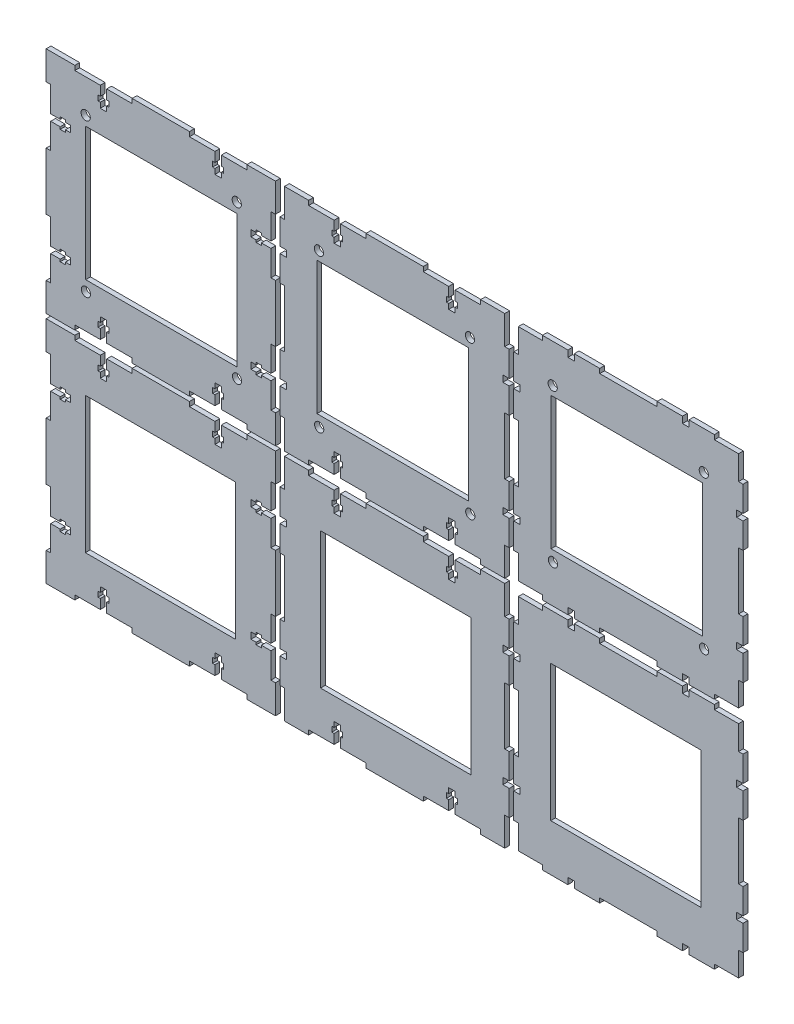
from build123d import *

# Parameters (mm, degrees)
MODEL_W               = 99.328164321
MODEL_H               = 90
BOSS_EXTRUDE1_DEPTH   = 3.175
BOSS_EXTRUDE1_2_DEPTH = 3.175
BOSS_EXTRUDE1_3_DEPTH = 3.175
MODEL_R               = 3.05
MODEL_W_2             = 99.973098966
MODEL_H_2             = 87.745085512
BOSS_EXTRUDE1_4_DEPTH = 3.175
MODEL_W_3             = 99.973098965
BOSS_EXTRUDE1_5_DEPTH = 3.175
BOSS_EXTRUDE1_6_DEPTH = 3.175


with BuildPart() as part:
    # Model → Boss-Extrude1 (new body)
    with BuildSketch(Plane.XY):
        Polygon((0, 154.39750188), (0, 135.470394989), (2.980646754, 135.470394989), (2.980646754, 118.65457955), (9.289682385, 118.65457955), (9.289682385, 120.144902927), (12.717426152, 120.144902927), (12.717426152, 118.65457955), (16.14516992, 118.65457955), (16.14516992, 114.431996648), (12.717426152, 114.431996648), (12.717426152, 112.94167327), (9.289682385, 112.94167327), (9.289682385, 114.431996648), (2.980646754, 114.431996648), (2.980646754, 97.616181208), (0, 97.616181208), (0, 59.761967427), (2.980646754, 59.761967427), (2.980646754, 42.946151987), (9.289682385, 42.946151987), (9.289682385, 44.436475364), (12.717426152, 44.436475364), (12.717426152, 42.946151987), (16.14516992, 42.946151987), (16.14516992, 38.723569085), (12.717426152, 38.723569085), (12.717426152, 37.233245708), (9.289682385, 37.233245708), (9.289682385, 38.723569085), (2.980646754, 38.723569085), (2.980646754, 21.907753645), (0, 21.907753645), (0, 2.980646754), (18.927106891, 2.980646754), (18.927106891, 5.961293509), (35.74292233, 5.961293509), (35.74292233, 12.270329139), (34.252598953, 12.270329139), (34.252598953, 15.698072907), (35.74292233, 15.698072907), (35.74292233, 19.125816674), (39.965505232, 19.125816674), (39.965505232, 15.698072907), (41.45582861, 15.698072907), (41.45582861, 12.270329139), (39.965505232, 12.270329139), (39.965505232, 5.961293509), (56.781320672, 5.961293509), (56.781320672, 2.980646754), (94.635534454, 2.980646754), (94.635534454, 5.961293509), (111.451349893, 5.961293509), (111.451349893, 12.270329139), (109.961026516, 12.270329139), (109.961026516, 15.698072907), (111.451349893, 15.698072907), (111.451349893, 19.125816674), (115.673932795, 19.125816674), (115.673932795, 15.698072907), (117.164256172, 15.698072907), (117.164256172, 12.270329139), (115.673932795, 12.270329139), (115.673932795, 5.961293509), (132.489748235, 5.961293509), (132.489748235, 2.980646754), (151.416855126, 2.980646754), (151.416855126, 21.907753645), (148.436208371, 21.907753645), (148.436208371, 38.723569085), (142.127172741, 38.723569085), (142.127172741, 37.233245708), (138.699428973, 37.233245708), (138.699428973, 38.723569085), (135.271685206, 38.723569085), (135.271685206, 42.946151987), (138.699428973, 42.946151987), (138.699428973, 44.436475364), (142.127172741, 44.436475364), (142.127172741, 42.946151987), (148.436208371, 42.946151987), (148.436208371, 59.761967427), (151.416855126, 59.761967427), (151.416855126, 97.616181208), (148.436208371, 97.616181208), (148.436208371, 114.431996648), (142.127172741, 114.431996648), (142.127172741, 112.94167327), (138.699428973, 112.94167327), (138.699428973, 114.431996648), (135.271685206, 114.431996648), (135.271685206, 118.65457955), (138.699428973, 118.65457955), (138.699428973, 120.144902927), (142.127172741, 120.144902927), (142.127172741, 118.65457955), (148.436208371, 118.65457955), (148.436208371, 135.470394989), (151.416855126, 135.470394989), (151.416855126, 154.39750188), (132.489748235, 154.39750188), (132.489748235, 151.416855126), (115.673932795, 151.416855126), (115.673932795, 145.107819495), (117.164256172, 145.107819495), (117.164256172, 141.680075728), (115.673932795, 141.680075728), (115.673932795, 138.25233196), (111.451349893, 138.25233196), (111.451349893, 141.680075728), (109.961026516, 141.680075728), (109.961026516, 145.107819495), (111.451349893, 145.107819495), (111.451349893, 151.416855126), (94.635534454, 151.416855126), (94.635534454, 154.39750188), (56.781320672, 154.39750188), (56.781320672, 151.416855126), (39.965505232, 151.416855126), (39.965505232, 145.107819495), (41.45582861, 145.107819495), (41.45582861, 141.680075728), (39.965505232, 141.680075728), (39.965505232, 138.25233196), (35.74292233, 138.25233196), (35.74292233, 141.680075728), (34.252598953, 141.680075728), (34.252598953, 145.107819495), (35.74292233, 145.107819495), (35.74292233, 151.416855126), (18.927106891, 151.416855126), (18.927106891, 154.39750188), align=None)
        with Locations((75.534273285, 78.552155403)):
            Rectangle(MODEL_W, MODEL_H, mode=Mode.SUBTRACT)
    extrude(amount=BOSS_EXTRUDE1_DEPTH)


with BuildPart() as body_2:
    # Model → Boss-Extrude1 2 (new body)
    with BuildSketch(Plane.XY):
        Polygon((157.378148634, 154.39750188), (157.378148634, 135.470394989), (154.39750188, 135.470394989), (154.39750188, 118.65457955), (158.620084782, 118.65457955), (158.620084782, 116.543288099), (158.620084782, 114.431996648), (154.39750188, 114.431996648), (154.39750188, 97.616181208), (157.378148634, 97.616181208), (157.378148634, 59.761967427), (154.39750188, 59.761967427), (154.39750188, 42.946151987), (158.620084782, 42.946151987), (158.620084782, 40.834860536), (158.620084782, 38.723569085), (154.39750188, 38.723569085), (154.39750188, 21.907753645), (157.378148634, 21.907753645), (157.378148634, 2.980646754), (173.324608771, 2.980646754), (173.324608771, 5.961293509), (190.14042421, 5.961293509), (190.14042421, 12.270329139), (188.650100833, 12.270329139), (188.650100833, 15.698072907), (190.14042421, 15.698072907), (190.14042421, 19.125816674), (194.363007113, 19.125816674), (194.363007113, 15.698072907), (195.85333049, 15.698072907), (195.85333049, 12.270329139), (194.363007113, 12.270329139), (194.363007113, 5.961293509), (211.178822552, 5.961293509), (211.178822552, 2.980646754), (249.033036334, 2.980646754), (249.033036334, 5.961293509), (265.848851773, 5.961293509), (265.848851773, 12.270329139), (264.358528396, 12.270329139), (264.358528396, 15.698072907), (265.848851773, 15.698072907), (265.848851773, 19.125816674), (270.071434675, 19.125816674), (270.071434675, 15.698072907), (271.561758053, 15.698072907), (271.561758053, 12.270329139), (270.071434675, 12.270329139), (270.071434675, 5.961293509), (286.887250115, 5.961293509), (286.887250115, 2.980646754), (302.833710251, 2.980646754), (302.833710251, 21.907753645), (305.814357006, 21.907753645), (305.814357006, 38.723569085), (301.591774104, 38.723569085), (301.591774104, 40.834860536), (301.591774104, 42.946151987), (305.814357006, 42.946151987), (305.814357006, 59.761967427), (302.833710251, 59.761967427), (302.833710251, 97.616181208), (305.814357006, 97.616181208), (305.814357006, 114.431996648), (301.591774104, 114.431996648), (301.591774104, 116.543288099), (301.591774104, 118.65457955), (305.814357006, 118.65457955), (305.814357006, 135.470394989), (302.833710251, 135.470394989), (302.833710251, 154.39750188), (286.887250115, 154.39750188), (286.887250115, 151.416855126), (270.071434675, 151.416855126), (270.071434675, 145.107819495), (271.561758053, 145.107819495), (271.561758053, 141.680075728), (270.071434675, 141.680075728), (270.071434675, 138.25233196), (265.848851773, 138.25233196), (265.848851773, 141.680075728), (264.358528396, 141.680075728), (264.358528396, 145.107819495), (265.848851773, 145.107819495), (265.848851773, 151.416855126), (249.033036334, 151.416855126), (249.033036334, 154.39750188), (211.178822552, 154.39750188), (211.178822552, 151.416855126), (194.363007113, 151.416855126), (194.363007113, 145.107819495), (195.85333049, 145.107819495), (195.85333049, 141.680075728), (194.363007113, 141.680075728), (194.363007113, 138.25233196), (190.14042421, 138.25233196), (190.14042421, 141.680075728), (188.650100833, 141.680075728), (188.650100833, 145.107819495), (190.14042421, 145.107819495), (190.14042421, 151.416855126), (173.324608771, 151.416855126), (173.324608771, 154.39750188), align=None)
        with Locations((230.857017421, 78.761485247)):
            Rectangle(MODEL_W, MODEL_H, mode=Mode.SUBTRACT)
    extrude(amount=BOSS_EXTRUDE1_2_DEPTH)


with BuildPart() as body_3:
    # Model → Boss-Extrude1 3 (new body)
    with BuildSketch(Plane.XY):
        Polygon((311.775650515, 151.416855126), (311.775650515, 135.470394989), (308.79500376, 135.470394989), (308.79500376, 118.65457955), (313.017586662, 118.65457955), (313.017586662, 116.543288099), (313.017586662, 114.431996648), (308.79500376, 114.431996648), (308.79500376, 97.616181208), (311.775650515, 97.616181208), (311.775650515, 59.761967427), (308.79500376, 59.761967427), (308.79500376, 42.946151987), (313.017586662, 42.946151987), (313.017586662, 40.834860536), (313.017586662, 38.723569085), (308.79500376, 38.723569085), (308.79500376, 21.907753645), (311.775650515, 21.907753645), (311.775650515, 5.961293509), (327.722110651, 5.961293509), (327.722110651, 2.980646754), (344.53792609, 2.980646754), (344.53792609, 7.203229657), (346.649217542, 7.203229657), (348.760508993, 7.203229657), (348.760508993, 2.980646754), (365.576324432, 2.980646754), (365.576324432, 5.961293509), (403.430538214, 5.961293509), (403.430538214, 2.980646754), (420.246353653, 2.980646754), (420.246353653, 7.203229657), (422.357645104, 7.203229657), (424.468936555, 7.203229657), (424.468936555, 2.980646754), (441.284751995, 2.980646754), (441.284751995, 5.961293509), (457.231212131, 5.961293509), (457.231212131, 21.907753645), (460.211858886, 21.907753645), (460.211858886, 38.723569085), (455.989275984, 38.723569085), (455.989275984, 40.834860536), (455.989275984, 42.946151987), (460.211858886, 42.946151987), (460.211858886, 59.761967427), (457.231212131, 59.761967427), (457.231212131, 97.616181208), (460.211858886, 97.616181208), (460.211858886, 114.431996648), (455.989275984, 114.431996648), (455.989275984, 116.543288099), (455.989275984, 118.65457955), (460.211858886, 118.65457955), (460.211858886, 135.470394989), (457.231212131, 135.470394989), (457.231212131, 151.416855126), (441.284751995, 151.416855126), (441.284751995, 154.39750188), (424.468936555, 154.39750188), (424.468936555, 150.174918978), (422.357645104, 150.174918978), (420.246353653, 150.174918978), (420.246353653, 154.39750188), (403.430538214, 154.39750188), (403.430538214, 151.416855126), (365.576324432, 151.416855126), (365.576324432, 154.39750188), (348.760508993, 154.39750188), (348.760508993, 150.174918978), (346.649217542, 150.174918978), (344.53792609, 150.174918978), (344.53792609, 154.39750188), (327.722110651, 154.39750188), (327.722110651, 151.416855126), align=None)
        with Locations((382.889096412, 78.933135719)):
            Rectangle(MODEL_W, MODEL_H, mode=Mode.SUBTRACT)
    extrude(amount=BOSS_EXTRUDE1_3_DEPTH)


with BuildPart() as body_4:
    # Model → Boss-Extrude1 4 (new body)
    with BuildSketch(Plane.XY):
        Polygon((0, 308.79500376), (0, 289.867896869), (2.980646754, 289.867896869), (2.980646754, 273.05208143), (9.289682385, 273.05208143), (9.289682385, 274.542404807), (12.717426152, 274.542404807), (12.717426152, 273.05208143), (16.14516992, 273.05208143), (16.14516992, 268.829498528), (12.717426152, 268.829498528), (12.717426152, 267.33917515), (9.289682385, 267.33917515), (9.289682385, 268.829498528), (2.980646754, 268.829498528), (2.980646754, 252.013683088), (0, 252.013683088), (0, 214.159469307), (2.980646754, 214.159469307), (2.980646754, 197.343653867), (9.289682385, 197.343653867), (9.289682385, 198.833977244), (12.717426152, 198.833977244), (12.717426152, 197.343653867), (16.14516992, 197.343653867), (16.14516992, 193.121070965), (12.717426152, 193.121070965), (12.717426152, 191.630747588), (9.289682385, 191.630747588), (9.289682385, 193.121070965), (2.980646754, 193.121070965), (2.980646754, 176.305255525), (0, 176.305255525), (0, 157.378148634), (18.927106891, 157.378148634), (18.927106891, 160.358795389), (35.74292233, 160.358795389), (35.74292233, 166.667831019), (34.252598953, 166.667831019), (34.252598953, 170.095574787), (35.74292233, 170.095574787), (35.74292233, 173.523318554), (39.965505232, 173.523318554), (39.965505232, 170.095574787), (41.45582861, 170.095574787), (41.45582861, 166.667831019), (39.965505232, 166.667831019), (39.965505232, 160.358795389), (56.781320672, 160.358795389), (56.781320672, 157.378148634), (94.635534454, 157.378148634), (94.635534454, 160.358795389), (111.451349893, 160.358795389), (111.451349893, 166.667831019), (109.961026516, 166.667831019), (109.961026516, 170.095574787), (111.451349893, 170.095574787), (111.451349893, 173.523318554), (115.673932795, 173.523318554), (115.673932795, 170.095574787), (117.164256172, 170.095574787), (117.164256172, 166.667831019), (115.673932795, 166.667831019), (115.673932795, 160.358795389), (132.489748235, 160.358795389), (132.489748235, 157.378148634), (151.416855126, 157.378148634), (151.416855126, 176.305255525), (148.436208371, 176.305255525), (148.436208371, 193.121070965), (142.127172741, 193.121070965), (142.127172741, 191.630747588), (138.699428973, 191.630747588), (138.699428973, 193.121070965), (135.271685206, 193.121070965), (135.271685206, 197.343653867), (138.699428973, 197.343653867), (138.699428973, 198.833977244), (142.127172741, 198.833977244), (142.127172741, 197.343653867), (148.436208371, 197.343653867), (148.436208371, 214.159469307), (151.416855126, 214.159469307), (151.416855126, 252.013683088), (148.436208371, 252.013683088), (148.436208371, 268.829498528), (142.127172741, 268.829498528), (142.127172741, 267.33917515), (138.699428973, 267.33917515), (138.699428973, 268.829498528), (135.271685206, 268.829498528), (135.271685206, 273.05208143), (138.699428973, 273.05208143), (138.699428973, 274.542404807), (142.127172741, 274.542404807), (142.127172741, 273.05208143), (148.436208371, 273.05208143), (148.436208371, 289.867896869), (151.416855126, 289.867896869), (151.416855126, 308.79500376), (132.489748235, 308.79500376), (132.489748235, 305.814357006), (115.673932795, 305.814357006), (115.673932795, 299.505321375), (117.164256172, 299.505321375), (117.164256172, 296.077577608), (115.673932795, 296.077577608), (115.673932795, 292.64983384), (111.451349893, 292.64983384), (111.451349893, 296.077577608), (109.961026516, 296.077577608), (109.961026516, 299.505321375), (111.451349893, 299.505321375), (111.451349893, 305.814357006), (94.635534454, 305.814357006), (94.635534454, 308.79500376), (56.781320672, 308.79500376), (56.781320672, 305.814357006), (39.965505232, 305.814357006), (39.965505232, 299.505321375), (41.45582861, 299.505321375), (41.45582861, 296.077577608), (39.965505232, 296.077577608), (39.965505232, 292.64983384), (35.74292233, 292.64983384), (35.74292233, 296.077577608), (34.252598953, 296.077577608), (34.252598953, 299.505321375), (35.74292233, 299.505321375), (35.74292233, 305.814357006), (18.927106891, 305.814357006), (18.927106891, 308.79500376), align=None)
        with Locations((26.087654184, 283.82694987)):
            Circle(MODEL_R, mode=Mode.SUBTRACT)
        with Locations(Location((125.873209609, 284.070712088, 0), (0, 0, 180))):
            Circle(MODEL_R, mode=Mode.SUBTRACT)
        with Locations((126.06075315, 183.180712088)):
            Circle(MODEL_R, mode=Mode.SUBTRACT)
        with Locations(Location((26.27542779, 182.933192277, 0), (0, 0, 180))):
            Circle(MODEL_R, mode=Mode.SUBTRACT)
        with Locations((76.074203667, 233.655845088)):
            Rectangle(MODEL_W_2, MODEL_H_2, mode=Mode.SUBTRACT)
    extrude(amount=BOSS_EXTRUDE1_4_DEPTH)


with BuildPart() as body_5:
    # Model → Boss-Extrude1 5 (new body)
    with BuildSketch(Plane.XY):
        Polygon((157.378148634, 308.79500376), (157.378148634, 289.867896869), (154.39750188, 289.867896869), (154.39750188, 273.05208143), (158.620084782, 273.05208143), (158.620084782, 270.940789979), (158.620084782, 268.829498528), (154.39750188, 268.829498528), (154.39750188, 252.013683088), (157.378148634, 252.013683088), (157.378148634, 214.159469307), (154.39750188, 214.159469307), (154.39750188, 197.343653867), (158.620084782, 197.343653867), (158.620084782, 195.232362416), (158.620084782, 193.121070965), (154.39750188, 193.121070965), (154.39750188, 176.305255525), (157.378148634, 176.305255525), (157.378148634, 157.378148634), (173.324608771, 157.378148634), (173.324608771, 160.358795389), (190.14042421, 160.358795389), (190.14042421, 166.667831019), (188.650100833, 166.667831019), (188.650100833, 170.095574787), (190.14042421, 170.095574787), (190.14042421, 173.523318554), (194.363007113, 173.523318554), (194.363007113, 170.095574787), (195.85333049, 170.095574787), (195.85333049, 166.667831019), (194.363007113, 166.667831019), (194.363007113, 160.358795389), (211.178822552, 160.358795389), (211.178822552, 157.378148634), (249.033036334, 157.378148634), (249.033036334, 160.358795389), (265.848851773, 160.358795389), (265.848851773, 166.667831019), (264.358528396, 166.667831019), (264.358528396, 170.095574787), (265.848851773, 170.095574787), (265.848851773, 173.523318554), (270.071434675, 173.523318554), (270.071434675, 170.095574787), (271.561758053, 170.095574787), (271.561758053, 166.667831019), (270.071434675, 166.667831019), (270.071434675, 160.358795389), (286.887250115, 160.358795389), (286.887250115, 157.378148634), (302.833710251, 157.378148634), (302.833710251, 176.305255525), (305.814357006, 176.305255525), (305.814357006, 193.121070965), (301.591774104, 193.121070965), (301.591774104, 195.232362416), (301.591774104, 197.343653867), (305.814357006, 197.343653867), (305.814357006, 214.159469307), (302.833710251, 214.159469307), (302.833710251, 252.013683088), (305.814357006, 252.013683088), (305.814357006, 268.829498528), (301.591774104, 268.829498528), (301.591774104, 270.940789979), (301.591774104, 273.05208143), (305.814357006, 273.05208143), (305.814357006, 289.867896869), (302.833710251, 289.867896869), (302.833710251, 308.79500376), (286.887250115, 308.79500376), (286.887250115, 305.814357006), (270.071434675, 305.814357006), (270.071434675, 299.505321375), (271.561758053, 299.505321375), (271.561758053, 296.077577608), (270.071434675, 296.077577608), (270.071434675, 292.64983384), (265.848851773, 292.64983384), (265.848851773, 296.077577608), (264.358528396, 296.077577608), (264.358528396, 299.505321375), (265.848851773, 299.505321375), (265.848851773, 305.814357006), (249.033036334, 305.814357006), (249.033036334, 308.79500376), (211.178822552, 308.79500376), (211.178822552, 305.814357006), (194.363007113, 305.814357006), (194.363007113, 299.505321375), (195.85333049, 299.505321375), (195.85333049, 296.077577608), (194.363007113, 296.077577608), (194.363007113, 292.64983384), (190.14042421, 292.64983384), (190.14042421, 296.077577608), (188.650100833, 296.077577608), (188.650100833, 299.505321375), (190.14042421, 299.505321375), (190.14042421, 305.814357006), (173.324608771, 305.814357006), (173.324608771, 308.79500376), align=None)
        with Locations((180.11937996, 283.411573885)):
            Circle(MODEL_R, mode=Mode.SUBTRACT)
        with Locations(Location((279.904935385, 283.655336103, 0), (0, 0, 180))):
            Circle(MODEL_R, mode=Mode.SUBTRACT)
        with Locations((280.092478925, 182.765336103)):
            Circle(MODEL_R, mode=Mode.SUBTRACT)
        with Locations(Location((180.307153566, 182.517816292, 0), (0, 0, 180))):
            Circle(MODEL_R, mode=Mode.SUBTRACT)
        with Locations((228.809276776, 233.418696208)):
            Rectangle(MODEL_W_3, MODEL_H_2, mode=Mode.SUBTRACT)
    extrude(amount=BOSS_EXTRUDE1_5_DEPTH)


with BuildPart() as body_6:
    # Model → Boss-Extrude1 6 (new body)
    with BuildSketch(Plane.XY):
        Polygon((311.775650515, 305.814357006), (311.775650515, 289.867896869), (308.79500376, 289.867896869), (308.79500376, 273.05208143), (313.017586662, 273.05208143), (313.017586662, 270.940789979), (313.017586662, 268.829498528), (308.79500376, 268.829498528), (308.79500376, 252.013683088), (311.775650515, 252.013683088), (311.775650515, 214.159469307), (308.79500376, 214.159469307), (308.79500376, 197.343653867), (313.017586662, 197.343653867), (313.017586662, 195.232362416), (313.017586662, 193.121070965), (308.79500376, 193.121070965), (308.79500376, 176.305255525), (311.775650515, 176.305255525), (311.775650515, 160.358795389), (327.722110651, 160.358795389), (327.722110651, 157.378148634), (344.53792609, 157.378148634), (344.53792609, 161.600731537), (346.649217542, 161.600731537), (348.760508993, 161.600731537), (348.760508993, 157.378148634), (365.576324432, 157.378148634), (365.576324432, 160.358795389), (403.430538214, 160.358795389), (403.430538214, 157.378148634), (420.246353653, 157.378148634), (420.246353653, 161.600731537), (422.357645104, 161.600731537), (424.468936555, 161.600731537), (424.468936555, 157.378148634), (441.284751995, 157.378148634), (441.284751995, 160.358795389), (457.231212131, 160.358795389), (457.231212131, 176.305255525), (460.211858886, 176.305255525), (460.211858886, 193.121070965), (455.989275984, 193.121070965), (455.989275984, 195.232362416), (455.989275984, 197.343653867), (460.211858886, 197.343653867), (460.211858886, 214.159469307), (457.231212131, 214.159469307), (457.231212131, 252.013683088), (460.211858886, 252.013683088), (460.211858886, 268.829498528), (455.989275984, 268.829498528), (455.989275984, 270.940789979), (455.989275984, 273.05208143), (460.211858886, 273.05208143), (460.211858886, 289.867896869), (457.231212131, 289.867896869), (457.231212131, 305.814357006), (441.284751995, 305.814357006), (441.284751995, 308.79500376), (424.468936555, 308.79500376), (424.468936555, 304.572420858), (422.357645104, 304.572420858), (420.246353653, 304.572420858), (420.246353653, 308.79500376), (403.430538214, 308.79500376), (403.430538214, 305.814357006), (365.576324432, 305.814357006), (365.576324432, 308.79500376), (348.760508993, 308.79500376), (348.760508993, 304.572420858), (346.649217542, 304.572420858), (344.53792609, 304.572420858), (344.53792609, 308.79500376), (327.722110651, 308.79500376), (327.722110651, 305.814357006), align=None)
        with Locations((334.51688184, 283.411573885)):
            Circle(MODEL_R, mode=Mode.SUBTRACT)
        with Locations(Location((434.302437265, 283.655336103, 0), (0, 0, 180))):
            Circle(MODEL_R, mode=Mode.SUBTRACT)
        with Locations((434.489980805, 182.765336103)):
            Circle(MODEL_R, mode=Mode.SUBTRACT)
        with Locations(Location((334.704655446, 182.517816292, 0), (0, 0, 180))):
            Circle(MODEL_R, mode=Mode.SUBTRACT)
        with Locations((383.430346381, 233.418696208)):
            Rectangle(MODEL_W_3, MODEL_H_2, mode=Mode.SUBTRACT)
    extrude(amount=BOSS_EXTRUDE1_6_DEPTH)


solid = Compound([part.part, body_2.part, body_3.part, body_4.part, body_5.part, body_6.part])
